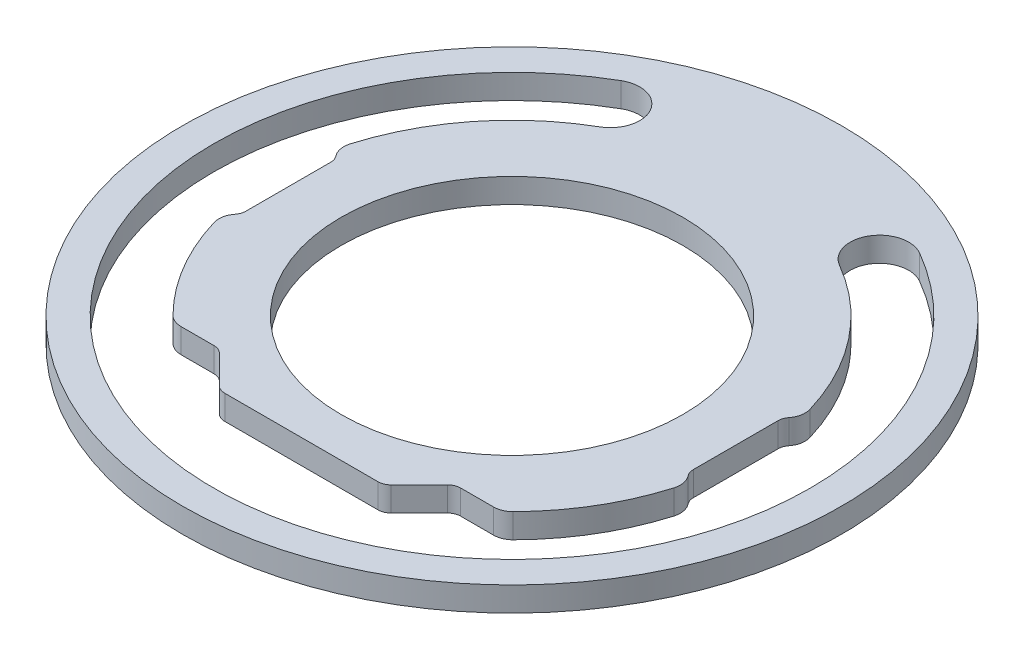
from build123d import *

# Parameters (mm, degrees)
SKETCH1_R           = 42.8625
SKETCH1_R_2         = 22.225
BOSS_EXTRUDE1_DEPTH = 3.175
CUT_EXTRUDE1_DEPTH  = 61.699822384
CUT_EXTRUDE3_DEPTH  = 61.699822384
FILLET1_R           = 2.54


with BuildPart() as part:
    # Sketch1 → Boss-Extrude1 (new body)
    with BuildSketch(Plane(origin=(0, 0, 0), x_dir=(1, 0, 0), z_dir=(0, 1, 0))):
        with Locations(Location((0, 0, 0), (0, 0, 270))):
            Circle(SKETCH1_R)
        with Locations(Location((0, 0, 0), (0, 0, 270))):
            Circle(SKETCH1_R_2, mode=Mode.SUBTRACT)
    extrude(amount=BOSS_EXTRUDE1_DEPTH)

    # Sketch2 → Cut-Extrude1 (cut, through all)
    with BuildSketch(Plane(origin=(0, 3.175, 0), x_dir=(1, 0, 0), z_dir=(0, 1, 0))):
        with BuildLine():
            ThreePointArc((19.39925, 33.600486629), (14.194693212, 32.20592984), (15.58925, 27.001373052))
            ThreePointArc((15.58925, 27.001373052), (0, -31.1785), (-15.58925, 27.001373052))
            ThreePointArc((-15.58925, 27.001373052), (-14.194693212, 32.20592984), (-19.39925, 33.600486629))
            ThreePointArc((-19.39925, 33.600486629), (0, -38.7985), (19.39925, 33.600486629))
        make_face()
    extrude(amount=-CUT_EXTRUDE1_DEPTH, mode=Mode.SUBTRACT)

    # Sketch6 → Cut-Extrude3 (cut, through all)
    with BuildSketch(Plane(origin=(0, 3.175, 0), x_dir=(1, 0, 0), z_dir=(0, 1, 0))):
        with BuildLine():
            Line((-21.34992109, -22.721789799), (-16.03711988, -22.721789799))
            ThreePointArc((-16.03711988, -22.721789799), (-15.390384879, -22.850433389), (-14.84210942, -23.216779339))
            Line((-14.84210942, -23.216779339), (-11.16498954, -26.893899219))
            ThreePointArc((-11.16498954, -26.893899219), (-10.61671408, -27.260245169), (-9.96997908, -27.388888759))
            Line((-9.96997908, -27.388888759), (9.96997908, -27.388888759))
            ThreePointArc((9.96997908, -27.388888759), (10.61671408, -27.260245169), (11.16498954, -26.893899219))
            Line((11.16498954, -26.893899219), (14.84210942, -23.216779339))
            ThreePointArc((14.84210942, -23.216779339), (15.390384879, -22.850433389), (16.03711988, -22.721789799))
            Line((16.03711988, -22.721789799), (21.34992109, -22.721789799))
            ThreePointArc((21.34992109, -22.721789799), (0, -31.1785), (-21.34992109, -22.721789799))
        make_face()
        with BuildLine():
            Line((29.1, -5.51000025), (29.1, 5.51000025))
            ThreePointArc((29.1, 5.51000025), (29.448279688, 6.53756368), (30.349569945, 7.14160111))
            ThreePointArc((30.349569945, 7.14160111), (31.1785, 0), (30.349569945, -7.14160111))
            ThreePointArc((30.349569945, -7.14160111), (29.448279688, -6.53756368), (29.1, -5.51000025))
        make_face()
        with BuildLine():
            Line((-29.1, 5.51000025), (-29.1, -5.51000025))
            ThreePointArc((-29.1, -5.51000025), (-29.448279688, -6.53756368), (-30.349569945, -7.14160111))
            ThreePointArc((-30.349569945, -7.14160111), (-31.1785, 0), (-30.349569945, 7.14160111))
            ThreePointArc((-30.349569945, 7.14160111), (-29.448279688, 6.53756368), (-29.1, 5.51000025))
        make_face()
    extrude(amount=-CUT_EXTRUDE3_DEPTH, mode=Mode.SUBTRACT)

    # Fillet1
    fillet1_edges = [part.edges().sort_by_distance(p)[0] for p in [
        (-30.349569945, 1.5875, 7.14160111),
        (-30.349569945, 1.5875, -7.14160111),
        (21.34992109, 1.5875, 22.721789799),
        (-21.34992109, 1.5875, 22.721789799),
        (30.349569945, 1.5875, -7.14160111),
        (30.349569945, 1.5875, 7.14160111),
    ]]
    fillet(fillet1_edges, radius=FILLET1_R)


solid = part.part
